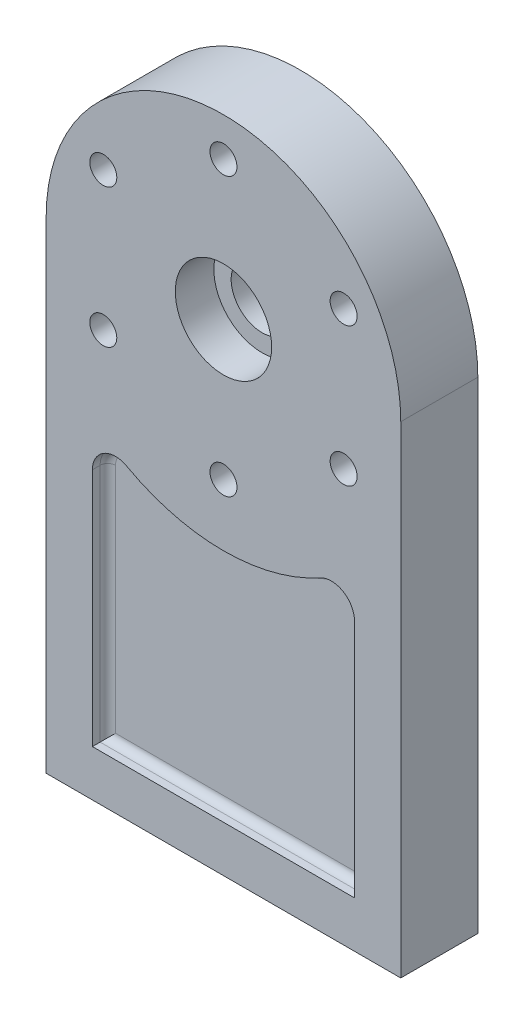
from build123d import *

# Parameters (mm, degrees)
SKETCH1_R                               = 8
BOSS_EXTRUDE1_DEPTH                     = 10
SKETCH3_R                               = 12.5
CUT_EXTRUDE1_DEPTH                      = 10
SKETCH4_R                               = 3.5
CUT_EXTRUDE2_DEPTH                      = 179.204938203
TAP_DRILL_FOR_M10X1_25_TAP1_D           = 8.8
TAP_DRILL_FOR_M10X1_25_TAP1_DEPTH       = 24
TAP_DRILL_FOR_M10X1_25_TAP1_CSINK_D     = 8.85
TAP_DRILL_FOR_M10X1_25_TAP1_CSINK_ANGLE = 90
TAP_DRILL_FOR_M10X1_25_TAP1_TIP         = 2.643786724
CUT_EXTRUDE4_DEPTH                      = 4
FILLET1_R                               = 2
FILLET1_OF_MIRROR1_R                    = 2
SKETCH9_R                               = 6
CUT_EXTRUDE5_DEPTH                      = 6
CIRPATTERN1_COUNT                       = 6


with BuildPart() as part:
    # Sketch1 → Boss-Extrude1 (new, symmetric)
    with BuildSketch(Plane.XY):
        with BuildLine():
            Line((46, 125), (46, 0))
            Line((46, 0), (-46, 0))
            Line((-46, 0), (-46, 125))
            ThreePointArc((-46, 125), (0, 171), (46, 125))
        make_face()
        with Locations((0, 125)):
            Circle(SKETCH1_R, mode=Mode.SUBTRACT)
    extrude(amount=BOSS_EXTRUDE1_DEPTH, both=True)

    # Sketch3 → Cut-Extrude1 (cut)
    with BuildSketch(Plane.XY.offset(10)):
        with Locations((0, 125)):
            Circle(SKETCH3_R)
    extrude(amount=-CUT_EXTRUDE1_DEPTH, mode=Mode.SUBTRACT)

    # Sketch4 → Cut-Extrude2 (cut, through all)
    with BuildSketch(Plane.XY.offset(10)):
        with Locations((0, 161)):
            Circle(SKETCH4_R)
    cut_extrude2 = extrude(amount=-CUT_EXTRUDE2_DEPTH, mode=Mode.SUBTRACT)

    # Tap Drill for M10x1.25 Tap1
    with Locations(Plane(origin=(0, 0, 0), x_dir=(-1, 0, 0), z_dir=(0, -1, 0))):
        with Locations((-30, 0), (30, 0)):
            CounterSinkHole(TAP_DRILL_FOR_M10X1_25_TAP1_D / 2, TAP_DRILL_FOR_M10X1_25_TAP1_CSINK_D / 2, depth=TAP_DRILL_FOR_M10X1_25_TAP1_DEPTH, counter_sink_angle=TAP_DRILL_FOR_M10X1_25_TAP1_CSINK_ANGLE)
            with Locations((0, 0, -(TAP_DRILL_FOR_M10X1_25_TAP1_DEPTH + TAP_DRILL_FOR_M10X1_25_TAP1_TIP / 2))):  # 118° drill point
                Cone(0, TAP_DRILL_FOR_M10X1_25_TAP1_D / 2, TAP_DRILL_FOR_M10X1_25_TAP1_TIP, mode=Mode.SUBTRACT)

    # Sketch8 → Cut-Extrude4 (cut)
    with BuildSketch(Plane.XY.offset(10)):
        with BuildLine():
            Line((-34, 74.206299603), (-34, 12))
            Line((-34, 12), (34, 12))
            Line((34, 12), (34, 74.206299603))
            ThreePointArc((34, 74.206299603), (31.051285766, 79.372502771), (25.103448276, 79.460820334))
            ThreePointArc((25.103448276, 79.460820334), (0, 73), (-25.103448276, 79.460820334))
            ThreePointArc((-25.103448276, 79.460820334), (-31.051285766, 79.372502771), (-34, 74.206299603))
        make_face()
    cut_extrude4 = extrude(amount=-CUT_EXTRUDE4_DEPTH, mode=Mode.SUBTRACT)

    # Fillet1
    fillet1_edges = [part.edges().sort_by_distance(p)[0] for p in [
        (31.051285766, 79.372502771, 6),
        (34, 43.103149802, 6),
        (0, 12, 6),
        (-34, 43.103149802, 6),
        (-31.051285766, 79.372502771, 6),
        (0, 73, 6),
    ]]
    fillet(fillet1_edges, radius=FILLET1_R)

    # Mirror1: Cut-Extrude4 across plane
    add(cut_extrude4.mirror(Plane.XY), mode=Mode.SUBTRACT)

    # Fillet1 of Mirror1
    fillet1_of_mirror1_edges = [part.edges().sort_by_distance(p)[0] for p in [
        (31.051285766, 79.372502771, -6),
        (34, 43.103149802, -6),
        (0, 12, -6),
        (-34, 43.103149802, -6),
        (-31.051285766, 79.372502771, -6),
        (0, 73, -6),
    ]]
    fillet(fillet1_of_mirror1_edges, radius=FILLET1_OF_MIRROR1_R)

    # Sketch9 → Cut-Extrude5 (cut)
    with BuildSketch(Plane(origin=(0, 0, -10), x_dir=(-1, 0, 0), z_dir=(0, 0, -1))):
        with Locations((0, 161)):
            Circle(SKETCH9_R)
    cut_extrude5 = extrude(amount=-CUT_EXTRUDE5_DEPTH, mode=Mode.SUBTRACT)

    # CirPattern1: Cut-Extrude2, Cut-Extrude5 ×6 about axis
    cirpattern1_axis = Axis((0, 125, 0), (0, 0, 1))
    add([cut_extrude2.rotate(cirpattern1_axis, i * 360 / CIRPATTERN1_COUNT) for i in range(1, CIRPATTERN1_COUNT)], mode=Mode.SUBTRACT)
    add([cut_extrude5.rotate(cirpattern1_axis, i * 360 / CIRPATTERN1_COUNT) for i in range(1, CIRPATTERN1_COUNT)], mode=Mode.SUBTRACT)


solid = part.part
